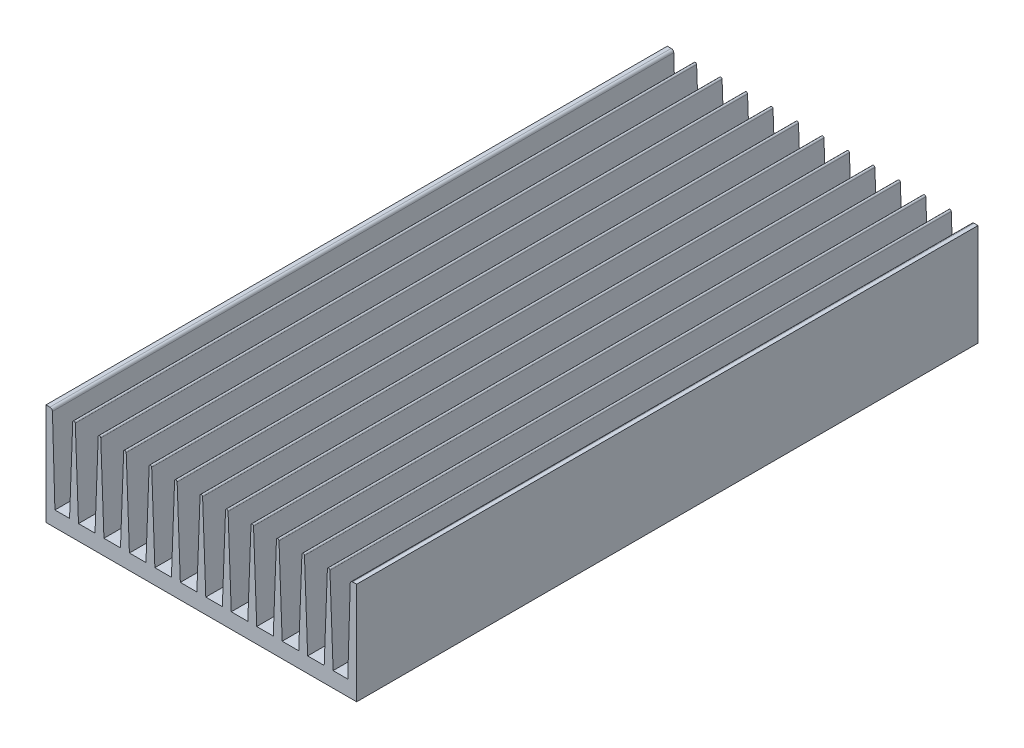
from build123d import *

# Parameters (mm, degrees)
EXTRUDE_1_DEPTH       = 244
EXTRUDE_3_DEPTH       = 244
PATTERN_CURVE_1_COUNT = 11
PATTERN_CURVE_1_PITCH = 10
SKETCH_3_R            = 2.25
CUT_EXTRUDE_1_DEPTH   = 6
SKETCH_4_R            = 1.25
SKETCH_4_R_2          = 1.6
CUT_EXTRUDE_2_DEPTH   = 5.5
SKETCH_5_R            = 2.1
SKETCH_5_R_2          = 1.6
CUT_EXTRUDE_3_DEPTH   = 6


with BuildPart() as part:
    # Эскиз1 → Вытянуть1 (new body)
    with BuildSketch(Plane.XY):
        with BuildLine():
            Line((0, 40), (1.528979332, 40))
            ThreePointArc((1.528979332, 40), (2.225614441, 39.717425624), (2.528547087, 39.029399052))
            Line((2.528547087, 39.029399052), (3.5, 6))
            Line((3.5, 6), (118.5, 6))
            Line((118.5, 6), (119.471452913, 39.029399052))
            ThreePointArc((119.471452913, 39.029399052), (119.774385559, 39.717425624), (120.471020668, 40))
            Line((120.471020668, 40), (122, 40))
            Line((122, 40), (122, 0))
            Line((122, 0), (0, 0))
            Line((0, 0), (0, 40))
        make_face()
    extrude(amount=EXTRUDE_1_DEPTH)

    # Эскиз2 → Вытянуть3 (add)
    with BuildSketch(Plane.XY.offset(244)):
        with BuildLine():
            Line((10.5, 39.5), (9.25, 6))
            Line((9.25, 6), (12.75, 6))
            Line((12.75, 6), (11.5, 39.5))
            ThreePointArc((11.5, 39.5), (11, 40), (10.5, 39.5))
        make_face()
    extrude_3 = extrude(amount=-EXTRUDE_3_DEPTH)

    # Кривая1: Вытянуть3 ×11
    with Locations(*[(i * PATTERN_CURVE_1_PITCH, 0, 0) for i in range(1, PATTERN_CURVE_1_COUNT)]):
        add(extrude_3)

    # Эскиз3 → Вырез-Вытянуть1 (cut)
    with BuildSketch(Plane.XZ):
        with Locations((26, 236)):
            Circle(SKETCH_3_R)
        with Locations((96, 236)):
            Circle(SKETCH_3_R)
        with Locations(Location((96, 8, 0), (0, 0, 180))):
            Circle(SKETCH_3_R)
        with Locations(Location((26, 8, 0), (0, 0, 180))):
            Circle(SKETCH_3_R)
    extrude(amount=-CUT_EXTRUDE_1_DEPTH, mode=Mode.SUBTRACT)

    # Эскиз4 → Вырез-Вытянуть2 (cut)
    with BuildSketch(Plane(origin=(-5.723570629, 0, -26.359021189), x_dir=(1, 0, 0), z_dir=(0, -1, 0))):
        with Locations((75.723570629, 72.359021189)):
            Circle(SKETCH_4_R)
        with Locations((90.223570629, 189.359021189)):
            Circle(SKETCH_4_R_2)
        with Locations((90.223570629, 49.359021189)):
            Circle(SKETCH_4_R_2)
        with Locations((57.223570629, 147.359021189)):
            Circle(SKETCH_4_R_2)
        with Locations((57.223570629, 128.359021189)):
            Circle(SKETCH_4_R_2)
        with Locations((75.723570629, 46.359021189)):
            Circle(SKETCH_4_R)
        with Locations((57.223570629, 116.359021189)):
            Circle(SKETCH_4_R_2)
        with Locations((57.223570629, 69.859021189)):
            Circle(SKETCH_4_R_2)
    extrude(amount=-CUT_EXTRUDE_2_DEPTH, mode=Mode.SUBTRACT)

    # Эскиз5 → Вырез-Вытянуть3 (cut)
    with BuildSketch(Plane(origin=(128.324191418, 0, 423.775874855), x_dir=(-1, 0, 0), z_dir=(0, -1, 0))):
        with Locations(Location((81.324191418, 273.775874855, 0), (0, 0, 180))):
            Circle(SKETCH_5_R)
        with Locations((21.324191418, 239.775874855)):
            Circle(SKETCH_5_R_2)
        with Locations((81.324191418, 239.775874855)):
            Circle(SKETCH_5_R_2)
        with Locations(Location((81.324191418, 204.775874855, 0), (0, 0, 180))):
            Circle(SKETCH_5_R_2)
        with Locations(Location((21.324191418, 204.775874855, 0), (0, 0, 180))):
            Circle(SKETCH_5_R_2)
    extrude(amount=-CUT_EXTRUDE_3_DEPTH, mode=Mode.SUBTRACT)


solid = part.part
